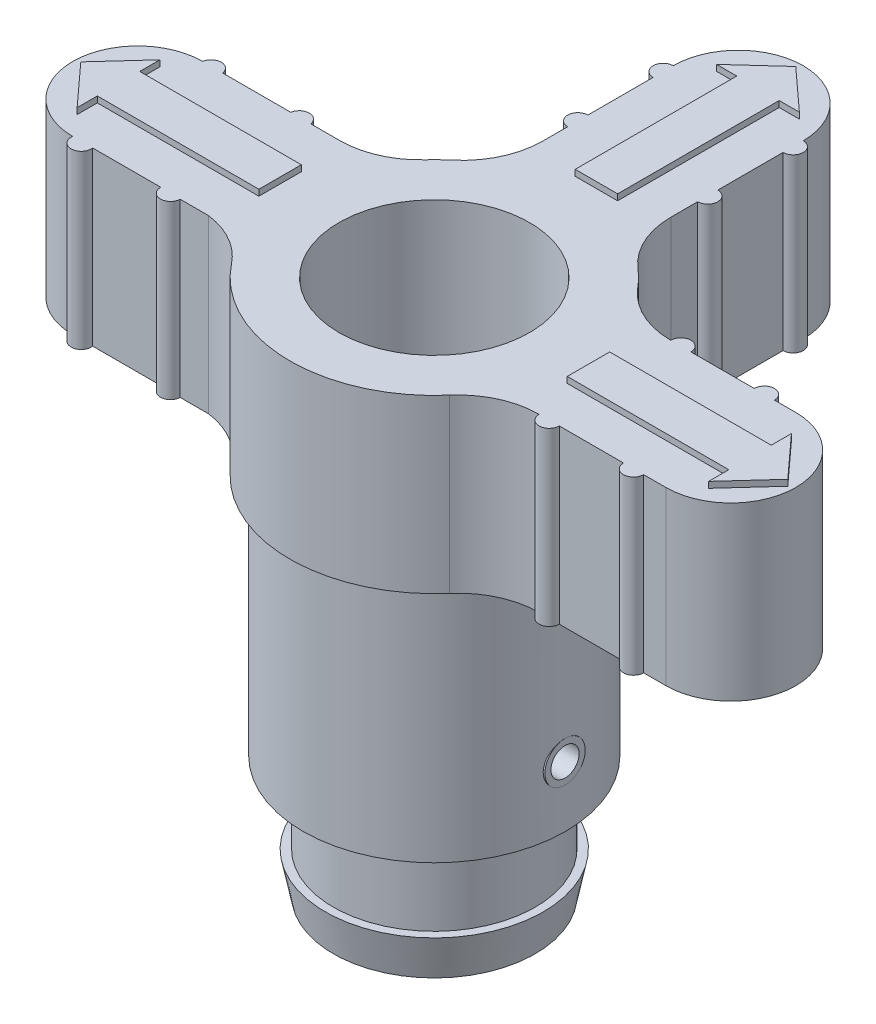
from build123d import *

# Parameters (mm, degrees)
SKETCH1_R            = 2.36
BOSS_EXTRUDE3_DEPTH  = 4.25
BOSS_EXTRUDE4_DEPTH  = 0.15
SKETCH6_R            = 3.25
BOSS_EXTRUDE5_DEPTH  = 6
SKETCH38_R           = 2
CUT_EXTRUDE22_DEPTH  = 17.556645736
SKETCH23_R           = 2.5
BOSS_EXTRUDE7_DEPTH  = 2
SKETCH25_R           = 2.5
SKETCH36_R           = 2.7
SKETCH14_R           = 2.36
CUT_EXTRUDE21_DEPTH  = 2.5
SKETCH10_R           = 0.5
CUT_EXTRUDE12_DEPTH  = 2
SKETCH17_R           = 0.5
BOSS_EXTRUDE11_DEPTH = 3
SKETCH10_7_R         = 0.5
BOSS_EXTRUDE12_DEPTH = 6.5
SKETCH32_R           = 0.348916491
CUT_EXTRUDE18_DEPTH  = 18.797082402
SKETCH34_R           = 0.35
CUT_EXTRUDE20_DEPTH  = 3
SKETCH39_R           = 2.36
CUT_EXTRUDE24_DEPTH  = 4
BOSS_EXTRUDE13_START = 1
SKETCH37_R           = 2.36
BOSS_EXTRUDE13_DEPTH = 1


with BuildPart() as part:
    # Sketch1 → Boss-Extrude3 (new body)
    with BuildSketch(Plane(origin=(0, 0, 0), x_dir=(1, 0, 0), z_dir=(0, 1, 0))):
        with BuildLine():
            Line((-1.58308264, 4.271080791), (-1.58308264, 4.886080791))
            ThreePointArc((-1.58308264, 4.886080791), (-1.83308264, 5.136080791), (-1.58308264, 5.386080791))
            Line((-1.58308264, 5.386080791), (-1.58308264, 7.001080791))
            ThreePointArc((-1.58308264, 7.001080791), (-1.83308264, 7.251080791), (-1.58308264, 7.501080791))
            ThreePointArc((-1.58308264, 7.501080791), (0.025243105, 9.109406536), (1.633568851, 7.501080791))
            ThreePointArc((1.633568851, 7.501080791), (1.883568851, 7.251080791), (1.633568851, 7.001080791))
            Line((1.633568851, 7.001080791), (1.633568851, 5.386080791))
            ThreePointArc((1.633568851, 5.386080791), (1.883568851, 5.136080791), (1.633568851, 4.886080791))
            Line((1.633568851, 4.886080791), (1.633568851, 4.228213539))
            ThreePointArc((1.633568851, 4.228213539), (1.8160093, 3.393661398), (2.330046128, 2.711365323))
            ThreePointArc((2.330046128, 2.711365323), (2.542876041, 2.512846656), (2.738852506, 2.297673568))
            ThreePointArc((2.738852506, 2.297673568), (3.425745216, 1.770515158), (4.271078172, 1.583085762))
            ThreePointArc((4.271078172, 1.583085762), (4.521078172, 1.833085762), (4.771078172, 1.583085762))
            Line((4.771078172, 1.583085762), (6.337990389, 1.583085762))
            ThreePointArc((6.337990389, 1.583085762), (6.587990389, 1.833085762), (6.837990389, 1.583085762))
            Line((6.837990389, 1.583085762), (7.367608221, 1.583085762))
            ThreePointArc((7.367608221, 1.583085762), (8.975933967, -0.025239984), (7.367608221, -1.63356573))
            Line((7.367608221, -1.63356573), (6.816554956, -1.63356573))
            ThreePointArc((6.816554956, -1.63356573), (6.566554956, -1.88356573), (6.316554956, -1.63356573))
            Line((6.316554956, -1.63356573), (4.728216222, -1.63356573))
            ThreePointArc((4.728216222, -1.63356573), (4.478216222, -1.88356573), (4.228216222, -1.63356573))
            ThreePointArc((4.228216222, -1.63356573), (3.393663409, -1.816006486), (2.711367044, -2.330044126))
            ThreePointArc((2.711367044, -2.330044126), (-0.076383132, -3.574182772), (-2.808435886, -2.212081542))
            ThreePointArc((-2.808435886, -2.212081542), (-3.393257828, -1.709739337), (-4.124639852, -1.465926436))
            Line((-4.124639852, -1.465926436), (-4.825145253, -1.465926436))
            ThreePointArc((-4.825145253, -1.465926436), (-5.081503124, -1.705967942), (-5.32154463, -1.449610071))
            Line((-5.32154463, -1.449610071), (-7.00651522, -1.449610071))
            ThreePointArc((-7.00651522, -1.449610071), (-7.253796444, -1.73637957), (-7.501077669, -1.449610071))
            ThreePointArc((-7.501077669, -1.449610071), (-9.109403415, 0.158715675), (-7.501077669, 1.76704142))
            ThreePointArc((-7.501077669, 1.76704142), (-7.253796444, 1.980271921), (-7.00651522, 1.76704142))
            Line((-7.00651522, 1.76704142), (-5.319551743, 1.76704142))
            ThreePointArc((-5.319551743, 1.76704142), (-5.072348498, 1.979751265), (-4.825145253, 1.76704142))
            Line((-4.825145253, 1.76704142), (-4.109745888, 1.76704142))
            ThreePointArc((-4.109745888, 1.76704142), (-3.304392096, 1.936357049), (-2.635397287, 2.415636151))
            ThreePointArc((-2.635397287, 2.415636151), (-2.471823123, 2.582771249), (-2.297671566, 2.738854186))
            ThreePointArc((-2.297671566, 2.738854186), (-1.770512345, 3.425747173), (-1.58308264, 4.271080791))
        make_face()
        Circle(SKETCH1_R, mode=Mode.SUBTRACT)
    extrude(amount=BOSS_EXTRUDE3_DEPTH)

    # Sketch3 → Boss-Extrude4 (add)
    with BuildSketch(Plane(origin=(0, 4.25, 0), x_dir=(1, 0, 0), z_dir=(0, 1, 0))):
        Polygon((-8.850160053, 0.098399174), (-7.915364191, 1.123579303), (-7.915364191, 0.623579303), (-3.915364191, 0.623579303), (-3.915364191, -0.426780956), (-7.915364191, -0.426780956), (-7.915364191, -0.926780956), align=None)
        Polygon((0.623579303, 7.915364191), (0.623579303, 3.915364191), (-0.426780956, 3.915364191), (-0.426780956, 7.915364191), (-0.926780956, 7.915364191), (0.098399174, 8.850160053), (1.123579303, 7.915364191), align=None)
        Polygon((7.915364191, -0.623579303), (3.915364191, -0.623579303), (3.915364191, 0.426780956), (7.915364191, 0.426780956), (7.915364191, 0.926780956), (8.850160053, -0.098399174), (7.915364191, -1.123579303), align=None)
    extrude(amount=BOSS_EXTRUDE4_DEPTH)


with BuildPart() as body_2:
    # Sketch6 → Boss-Extrude5 (new body)
    with BuildSketch(Plane(origin=(0, 0, 0), x_dir=(-1, 0, 0), z_dir=(0, -1, 0))):
        Circle(SKETCH6_R)
    extrude(amount=BOSS_EXTRUDE5_DEPTH)

    # Sketch38 → Cut-Extrude22 (cut, through all)
    with BuildSketch(Plane.XZ.offset(6)):
        Circle(SKETCH38_R)
    extrude(amount=-CUT_EXTRUDE22_DEPTH, mode=Mode.SUBTRACT)


with BuildPart() as body_3:
    # Sketch23 → Boss-Extrude7 (new body)
    with BuildSketch(Plane(origin=(0, -6, 0), x_dir=(-1, 0, 0), z_dir=(0, -1, 0))):
        Circle(SKETCH23_R)
    extrude(amount=BOSS_EXTRUDE7_DEPTH)

    # Sketch25 → Loft3 section 0
    with BuildSketch(Plane(origin=(0, -9, 0), x_dir=(-1, 0, 0), z_dir=(0, -1, 0))):
        Circle(SKETCH25_R)
    # Sketch36 → Loft3 section 1
    with BuildSketch(Plane(origin=(0, -8, 0), x_dir=(-1, 0, 0), z_dir=(0, -1, 0))):
        Circle(SKETCH36_R)
    loft()


with BuildPart() as cut_extrude21_tool:
    # Sketch14 → Cut-Extrude21 (new, symmetric)
    with BuildSketch(Plane.XZ.offset(6)):
        Circle(SKETCH14_R)
    extrude(amount=CUT_EXTRUDE21_DEPTH, both=True)


with BuildPart() as body_2_1:
    add(body_2.part)

    # Cut-Extrude21: cut by cut_extrude21_tool
    add(cut_extrude21_tool.part, mode=Mode.SUBTRACT)

    # Sketch10 → Cut-Extrude12 (cut)
    with BuildSketch(Plane(origin=(3.25, 0, 0), x_dir=(0, 0, -1), z_dir=(1, 0, 0))):
        with Locations((-0.012648171, -4.5)):
            Circle(SKETCH10_R)
    extrude(amount=-CUT_EXTRUDE12_DEPTH, mode=Mode.SUBTRACT)

    # Sketch17 → Boss-Extrude11 (add)
    with BuildSketch(Plane(origin=(0.10876296, 0.262318781, -3.25), x_dir=(-1, 0, 0), z_dir=(0, 0, -1))):
        with Locations((0.312467195, -4.783286307)):
            Circle(SKETCH17_R)
    extrude(amount=-BOSS_EXTRUDE11_DEPTH)

    # Sketch10<7> → Boss-Extrude12 (add)
    with BuildSketch(Plane(origin=(3.25, 0, 0), x_dir=(0, 0, -1), z_dir=(1, 0, 0))):
        with Locations((-0.012648171, -4.5)):
            Circle(SKETCH10_7_R)
    extrude(amount=-BOSS_EXTRUDE12_DEPTH)

    # Sketch32 → Cut-Extrude18 (cut, through all)
    with BuildSketch(Plane(origin=(3.25, 0, 0), x_dir=(0, 0, -1), z_dir=(1, 0, 0))):
        with Locations((-0.012648171, -4.5)):
            Circle(SKETCH32_R)
    extrude(amount=-CUT_EXTRUDE18_DEPTH, mode=Mode.SUBTRACT)

    # Sketch34 → Cut-Extrude20 (cut)
    with BuildSketch(Plane(origin=(0, 0, -3.25), x_dir=(-1, 0, 0), z_dir=(0, 0, -1))):
        with Locations((0.203704234, -4.520967526)):
            Circle(SKETCH34_R)
    extrude(amount=-CUT_EXTRUDE20_DEPTH, mode=Mode.SUBTRACT)


with BuildPart() as body_3_1:
    add(body_3.part)

    # Cut-Extrude21: cut by cut_extrude21_tool
    add(cut_extrude21_tool.part, mode=Mode.SUBTRACT)


with BuildPart() as cut_extrude24_tool:
    # Sketch39 → Cut-Extrude24 (new, symmetric)
    with BuildSketch(Plane.XZ.offset(9)):
        Circle(SKETCH39_R)
    extrude(amount=CUT_EXTRUDE24_DEPTH, both=True)


with BuildPart() as body_2_2:
    add(body_2_1.part)

    # Cut-Extrude24: cut by cut_extrude24_tool
    add(cut_extrude24_tool.part, mode=Mode.SUBTRACT)

    # Sketch37 → Boss-Extrude13 (add)
    with BuildSketch(Plane(origin=(0, -1, 0), x_dir=(-1, 0, 0), z_dir=(0, -1, 0)).offset(BOSS_EXTRUDE13_START)):
        Circle(SKETCH37_R)
    extrude(amount=-BOSS_EXTRUDE13_DEPTH)


with BuildPart() as body_3_2:
    add(body_3_1.part)

    # Cut-Extrude24: cut by cut_extrude24_tool
    add(cut_extrude24_tool.part, mode=Mode.SUBTRACT)


solid = Compound([part.part, body_2_2.part, body_3_2.part])
